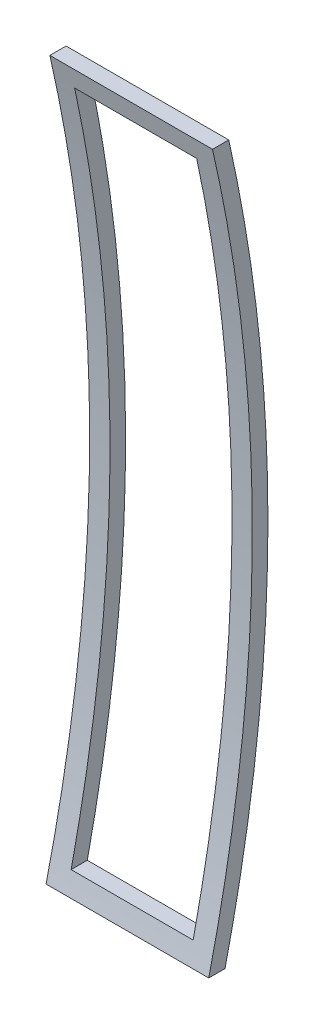
from build123d import *

# Parameters (mm, degrees)
SKETCH1_W           = 508
SKETCH1_H           = 2235.2
BOSS_EXTRUDE1_DEPTH = 317.5
CUT_EXTRUDE1_DEPTH  = 2315.084978993
SKETCH4_W           = 381
SKETCH4_H           = 2108.2
CUT_EXTRUDE2_DEPTH  = 635


with BuildPart() as part:
    # Sketch1 → Boss-Extrude1 (new, symmetric)
    with BuildSketch(Plane.XY):
        with Locations((254, 1117.6)):
            Rectangle(SKETCH1_W, SKETCH1_H)
    extrude(amount=BOSS_EXTRUDE1_DEPTH, both=True)

    # Sketch3 → Cut-Extrude1 (cut, through all)
    with BuildSketch(Plane(origin=(0, 0, 0), x_dir=(0, 0, -1), z_dir=(1, 0, 0))):
        with BuildLine():
            add(Edge.make_bspline(
                [(11.821569446, 2235.2), (53.57813934, 2051.592772393), (85.222640891, 1866.207447857), (107.434189609, 1667.229087385), (108.698878545, 1655.516041361), (111.142504459, 1632.089911804), (114.679903907, 1596.945609992), (122.036747111, 1514.906454342), (126.801961515, 1444.525721695), (134.27079546, 1303.68201965), (136.501210965, 1209.676568729), (135.828775663, 1092.031717992), (135.367512593, 1056.727910054), (134.516268219, 1021.408545813), (133.862033824, 997.858843012), (133.491664454, 986.086879756), (131.424864721, 927.264731081), (129.082951268, 880.304237017), (120.017272868, 739.710830806), (111.253713841, 646.365974306), (77.002317609, 367.455601671), (43.555969623, 183.013970543), (0, 0)],
                knots=[0, 0, 0, 0, 0.25, 0.25, 0.265625, 0.265625, 0.28125, 0.3125, 0.375, 0.375, 0.5, 0.5, 0.53125, 0.546875, 0.546875, 0.5625, 0.5625, 0.625, 0.625, 0.75, 0.75, 1, 1, 1, 1], degree=3))
            Line((0, 0), (-317.5, 0))
            Line((-317.5, 0), (-317.5, 2235.2))
            Line((-317.5, 2235.2), (11.821569446, 2235.2))
        make_face()
        with BuildLine():
            add(Edge.make_bspline(
                [(50.8, 0), (93.756857966, 183.282593988), (126.706271475, 367.938495881), (160.41784485, 647.078560023), (169.0357287, 740.484692023), (176.456558681, 857.702282187), (178.431425593, 892.902056056), (180.026988846, 928.153881246), (181.00615785, 951.666699325), (181.45337598, 963.426998719), (183.476257054, 1022.212785523), (184.41367603, 1069.223486353), (185.187938722, 1210.201925792), (182.986794075, 1304.116001508), (175.627644988, 1444.880277597), (171.716032673, 1503.509801444), (166.750196414, 1562.111566197), (164.679571807, 1585.55005263), (163.601939023, 1597.269959678), (160.24444438, 1632.408236744), (157.839846087, 1655.8074259), (134.712079658, 1866.164757361), (103.588202999, 2051.475930795), (62.441666667, 2235.2)],
                knots=[0, 0, 0, 0, 0.25, 0.25, 0.375, 0.375, 0.40625, 0.421875, 0.421875, 0.4375, 0.4375, 0.5, 0.5, 0.625, 0.625, 0.6875, 0.703125, 0.703125, 0.71875, 0.71875, 0.75, 0.75, 1, 1, 1, 1], degree=3))
            Line((62.441666667, 2235.2), (317.5, 2235.2))
            Line((317.5, 2235.2), (317.5, 0))
            Line((317.5, 0), (50.8, 0))
        make_face()
    extrude(amount=CUT_EXTRUDE1_DEPTH, mode=Mode.SUBTRACT)

    # Sketch4 → Cut-Extrude2 (cut)
    with BuildSketch(Plane.XY):
        with Locations((254, 1117.6)):
            Rectangle(SKETCH4_W, SKETCH4_H)
    extrude(amount=-CUT_EXTRUDE2_DEPTH, mode=Mode.SUBTRACT)


solid = part.part
